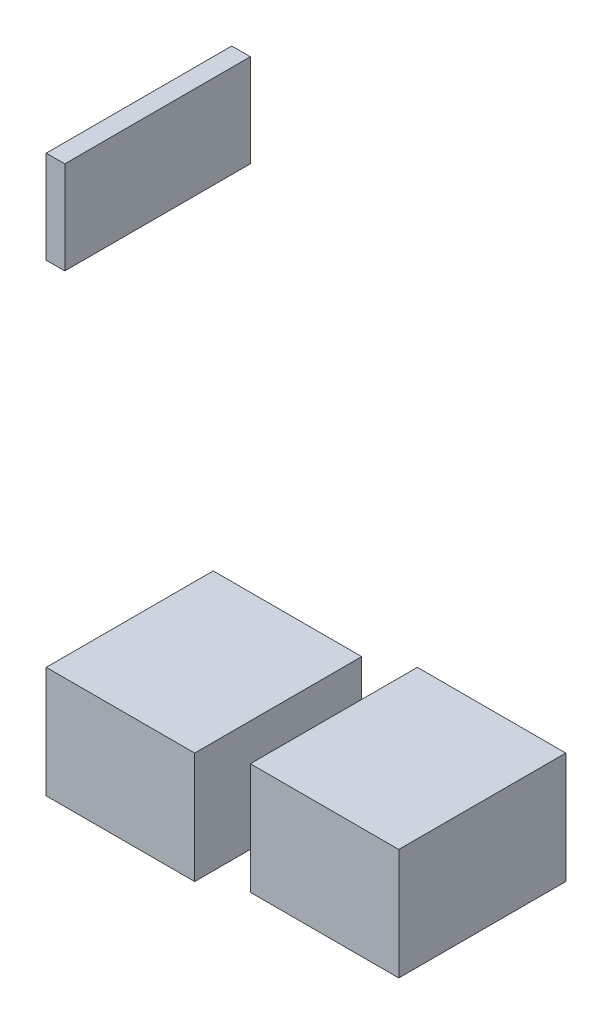
from build123d import *

# Parameters (mm, degrees)
SKETCH5_W           = 8
SKETCH5_H           = 9
BOSS_EXTRUDE2_DEPTH = 6
SKETCH10_W          = 8
SKETCH10_H          = 9
BOSS_EXTRUDE3_DEPTH = 6
CUT_EXTRUDE1_DEPTH  = 2
SKETCH17_W          = 1
SKETCH17_H          = 5
BOSS_EXTRUDE4_DEPTH = 10


with BuildPart() as part:
    # Sketch5 → Boss-Extrude2 (new body)
    with BuildSketch(Plane(origin=(0, -24, 0), x_dir=(-1, 0, 0), z_dir=(0, -1, 0))):
        with Locations((-4, -5.5)):
            Rectangle(SKETCH5_W, SKETCH5_H)
    extrude(amount=-BOSS_EXTRUDE2_DEPTH)


with BuildPart() as body_2:
    # Sketch10 → Boss-Extrude3 (new body)
    with BuildSketch(Plane(origin=(0, -18, 0), x_dir=(1, 0, 0), z_dir=(0, 1, 0))):
        with Locations((14, -4.5)):
            Rectangle(SKETCH10_W, SKETCH10_H)
    extrude(amount=-BOSS_EXTRUDE3_DEPTH)

    # Sketch11 → Cut-Extrude1 (cut)
    with BuildSketch(Plane.ZY.offset(-10)):
        Polygon((8.25, -21), (6.625, -18.185417438), (3.375, -18.185417438), (1.75, -21), (3.375, -23.814582562), (6.625, -23.814582562), align=None)
    extrude(amount=-CUT_EXTRUDE1_DEPTH, mode=Mode.SUBTRACT)


with BuildPart() as body_3:
    # Sketch17 → Boss-Extrude4 (new body)
    with BuildSketch(Plane(origin=(0, 0, 0), x_dir=(-1, 0, 0), z_dir=(0, 0, -1))):
        with Locations((-0.5, 3.5)):
            Rectangle(SKETCH17_W, SKETCH17_H)
    extrude(amount=-BOSS_EXTRUDE4_DEPTH)


solid = Compound([part.part, body_2.part, body_3.part])
